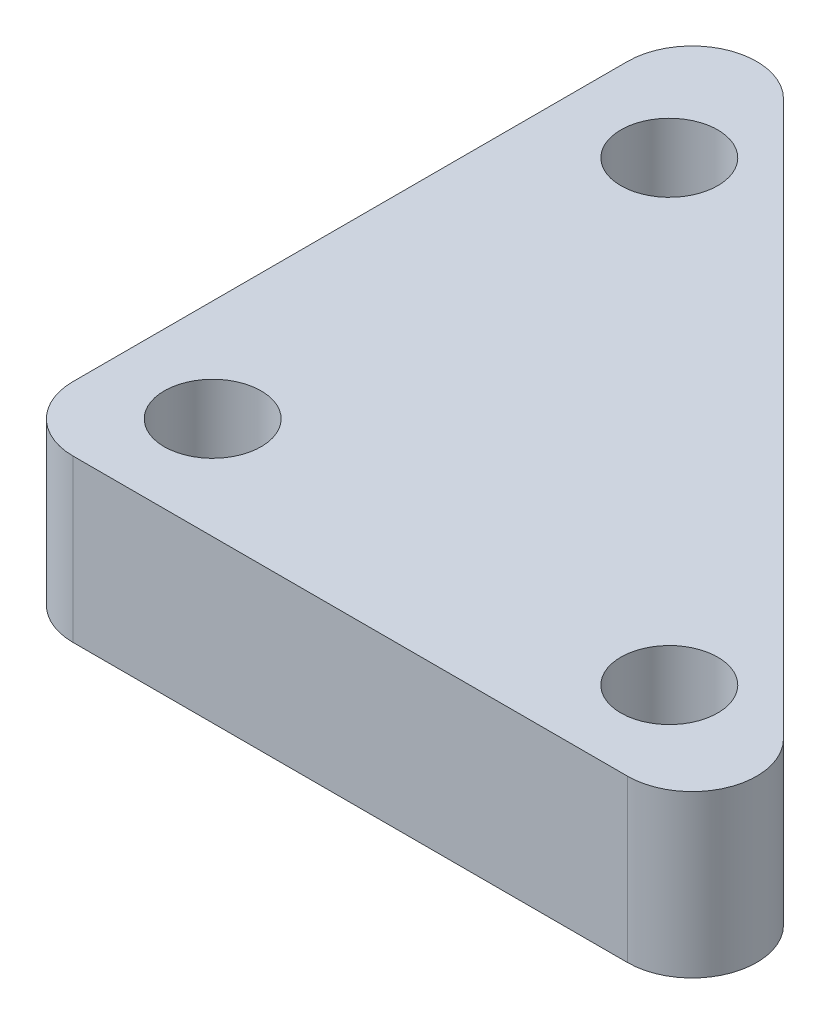
from build123d import *

# Parameters (mm, degrees)
BOSS_EXTRUDE1_DEPTH = 5
FILLET1_R           = 2
SKETCH2_R           = 1.5
CUT_EXTRUDE1_DEPTH  = 28.422694299


with BuildPart() as part:
    # Sketch1 → Boss-Extrude1 (new body)
    with BuildSketch(Plane(origin=(0, 0, 0), x_dir=(1, 0, 0), z_dir=(0, 1, 0))):
        Polygon((-0.813390539, -17.679043374), (23.186609461, -17.679043374), (-0.813390539, 6.320956626), align=None)
    extrude(amount=BOSS_EXTRUDE1_DEPTH)

    # Fillet1
    fillet1_edges = [part.edges().sort_by_distance(p)[0] for p in [
        (-0.813390539, 2.5, -6.320956626),
        (23.186609461, 2.5, 17.679043374),
        (-0.813390539, 2.5, 17.679043374),
    ]]
    fillet(fillet1_edges, radius=FILLET1_R)

    # Sketch2 → Cut-Extrude1 (cut, through all)
    with BuildSketch(Plane(origin=(0, 5, 0), x_dir=(1, 0, 0), z_dir=(0, 1, 0))):
        with Locations(Location((2.347774696, -14.517878139, 0), (0, 0, 270))):
            Circle(SKETCH2_R)
        with Locations(Location((2.41824209, -0.446209909, 0), (0, 0, 270))):
            Circle(SKETCH2_R)
        with Locations(Location((16.560377713, -14.588345533, 0), (0, 0, 270))):
            Circle(SKETCH2_R)
    extrude(amount=-CUT_EXTRUDE1_DEPTH, mode=Mode.SUBTRACT)


solid = part.part
